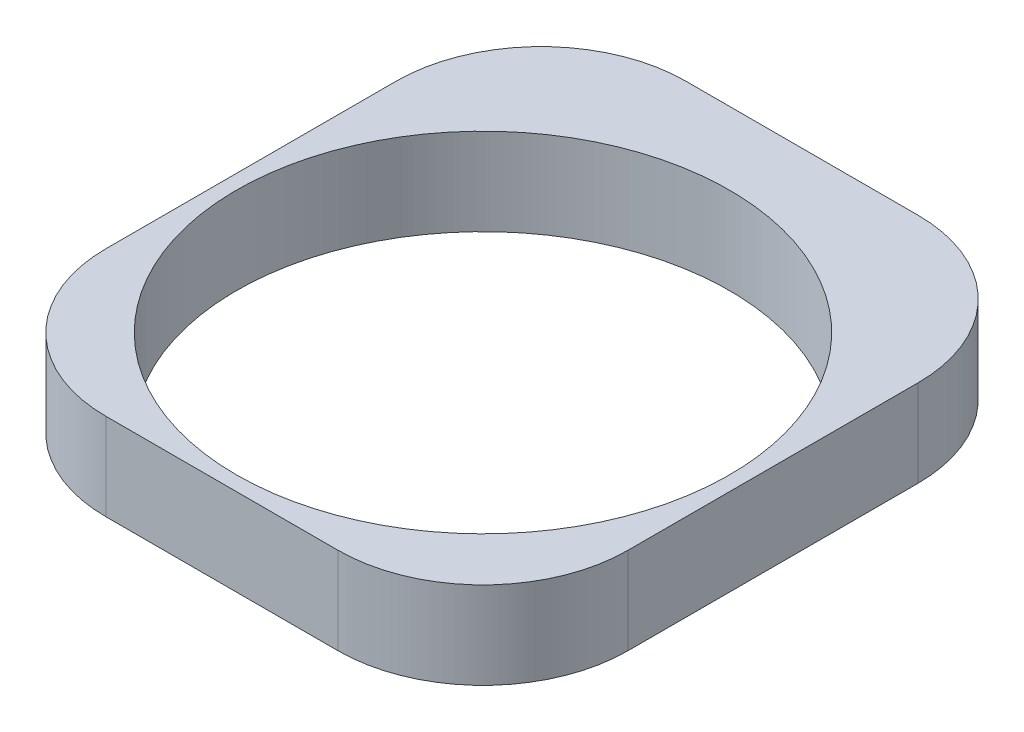
from build123d import *

# Parameters (mm, degrees)
SKETCH1_W           = 180
SKETCH1_H           = 200
BOSS_EXTRUDE1_DEPTH = 30
SKETCH7_R           = 85
CUT_EXTRUDE1_DEPTH  = 40
FILLET1_R           = 50
FILLET2_R           = 50
FILLET3_R           = 50
FILLET4_R           = 50


with BuildPart() as part:
    # Sketch1 → Boss-Extrude1 (new body)
    with BuildSketch(Plane(origin=(0, 0, 0), x_dir=(1, 0, 0), z_dir=(0, 1, 0))):
        with Locations((-90, 100)):
            Rectangle(SKETCH1_W, SKETCH1_H)
    extrude(amount=BOSS_EXTRUDE1_DEPTH)

    # Sketch7 → Cut-Extrude1 (cut)
    with BuildSketch(Plane(origin=(0, 30, 0), x_dir=(1, 0, 0), z_dir=(0, 1, 0))):
        with Locations(Location((-90, 90, 0), (0, 0, 270))):
            Circle(SKETCH7_R)
    extrude(amount=-CUT_EXTRUDE1_DEPTH, mode=Mode.SUBTRACT)

    # Fillet1
    fillet1_edges = [part.edges().sort_by_distance(p)[0] for p in [
        (0, 15, -200),
    ]]
    fillet(fillet1_edges, radius=FILLET1_R)

    # Fillet2
    fillet2_edges = [part.edges().sort_by_distance(p)[0] for p in [
        (0, 15, 0),
    ]]
    fillet(fillet2_edges, radius=FILLET2_R)

    # Fillet3
    fillet3_edges = [part.edges().sort_by_distance(p)[0] for p in [
        (-180, 15, 0),
    ]]
    fillet(fillet3_edges, radius=FILLET3_R)

    # Fillet4
    fillet4_edges = [part.edges().sort_by_distance(p)[0] for p in [
        (-180, 15, -200),
    ]]
    fillet(fillet4_edges, radius=FILLET4_R)


solid = part.part
